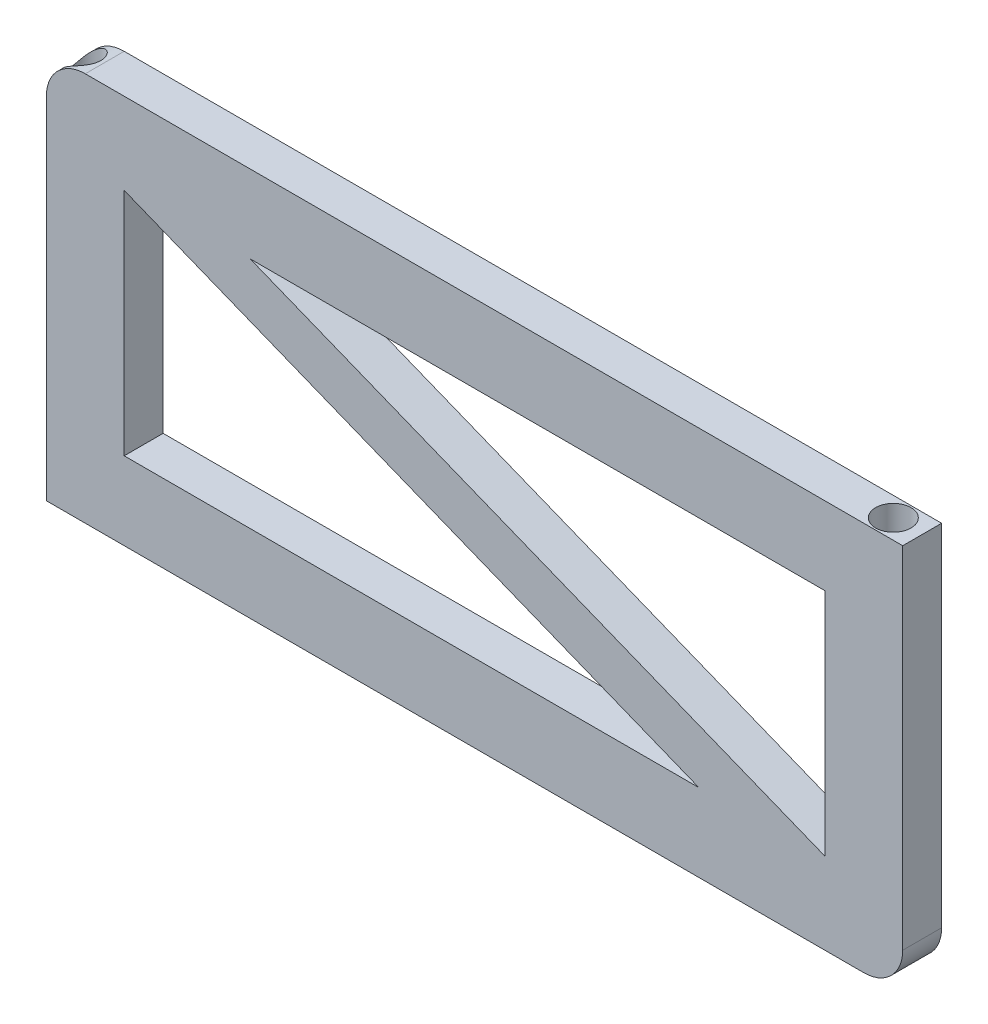
from build123d import *

# Parameters (mm, degrees)
BOSS_EXTRUDE1_DEPTH              = 10
F_8_0_8_DIAMETER_HOLE1_D         = 8
F_1_8_27_NPSM_TAPPED_HOLE1_D     = 9.0932
F_1_8_27_NPSM_TAPPED_HOLE1_DEPTH = 22.99
F_1_8_27_NPSM_TAPPED_HOLE1_TIP   = 2.73187289


with BuildPart() as part:
    # Sketch1 → Boss-Extrude1 (new body)
    with BuildSketch(Plane.XY):
        with BuildLine():
            Line((-10, -10), (-10, 80))
            ThreePointArc((-10, 80), (-7.071067812, 87.071067812), (0, 90))
            Line((0, 90), (210, 90))
            Line((210, 90), (210, 0))
            ThreePointArc((210, 0), (207.071067812, -7.071067812), (200, -10))
            Line((200, -10), (-10, -10))
        make_face()
        Polygon((42.360679775, 70), (190, 70), (190, 10.94427191), align=None, mode=Mode.SUBTRACT)
        Polygon((10, 10), (10, 69.05572809), (157.639320225, 10), align=None, mode=Mode.SUBTRACT)
    extrude(amount=BOSS_EXTRUDE1_DEPTH)

    # Ø8.0 (8) Diameter Hole1 (through all)
    with Locations(Plane(origin=(0, -10, 0), x_dir=(-1, 0, 0), z_dir=(0, -1, 0))):
        with Locations((5, -5)):
            Hole(F_8_0_8_DIAMETER_HOLE1_D / 2)

    # 1/8-27 NPSM Tapped Hole1
    with Locations(Plane(origin=(0, 90, 0), x_dir=(1, 0, 0), z_dir=(0, 1, 0))):
        with Locations((202.585893874, -5)):
            Hole(F_1_8_27_NPSM_TAPPED_HOLE1_D / 2, depth=F_1_8_27_NPSM_TAPPED_HOLE1_DEPTH)
            with Locations((0, 0, -(F_1_8_27_NPSM_TAPPED_HOLE1_DEPTH + F_1_8_27_NPSM_TAPPED_HOLE1_TIP / 2))):  # 118° drill point
                Cone(0, F_1_8_27_NPSM_TAPPED_HOLE1_D / 2, F_1_8_27_NPSM_TAPPED_HOLE1_TIP, mode=Mode.SUBTRACT)


solid = part.part
